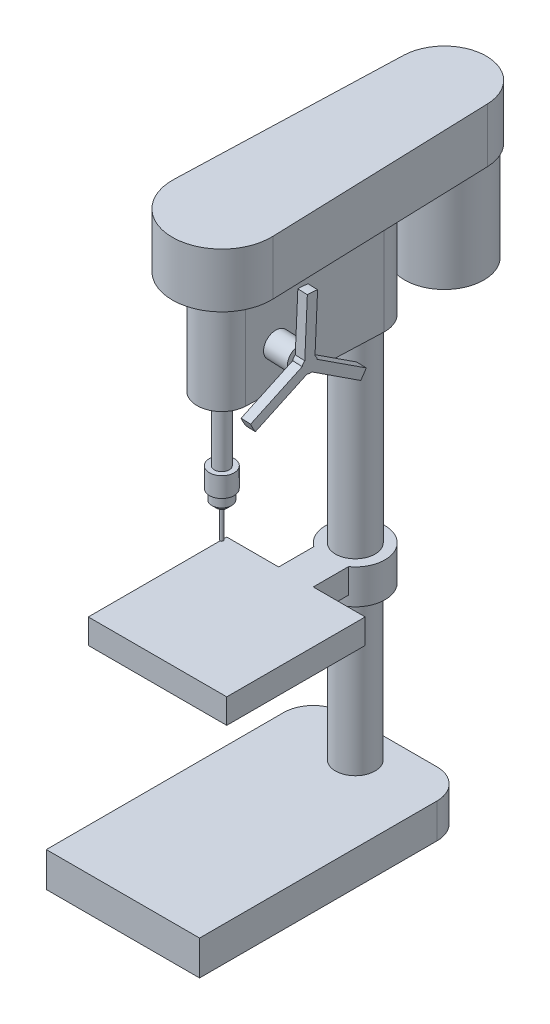
from build123d import *

# Parameters (mm, degrees)
SKETCH_1_W          = 310
SKETCH_1_H          = 540
EXTRUDE_1_DEPTH     = 70
FILLET_1_R          = 60
SKETCH_2_R          = 40
EXTRUDE_2_DEPTH     = 310
SKETCH_3_R          = 60
EXTRUDE_3_DEPTH     = 20
EXTRUDE_4_DEPTH     = 50
SKETCH_5_R          = 40
EXTRUDE_5_DEPTH     = 400
EXTRUDE_6_DEPTH     = 210
EXTRUDE_7_DEPTH     = 110
SKETCH_10_R         = 80
EXTRUDE_8_DEPTH     = 200
SKETCH_11_R         = 15
EXTRUDE_9_DEPTH     = 130
SKETCH_12_R         = 25
EXTRUDE_10_DEPTH    = 40
SKETCH_13_R         = 20
EXTRUDE_11_DEPTH    = 30
CHAMFER_1_SIZE      = 10
SKETCH_14_R         = 3.5
EXTRUDE_12_DEPTH    = 60
SKETCH_15_R         = 25
EXTRUDE_13_DEPTH    = 50
SKETCH_16_R         = 125
EXTRUDE_14_DEPTH    = 20
CUT_EXTRUDE_START   = -20
CUT_EXTRUDE_1_DEPTH = 20


with BuildPart() as part:
    # ｽｹｯﾁ1 → ﾎﾞｽ - 押し出し1 (new body)
    with BuildSketch(Plane(origin=(0, 0, 0), x_dir=(1, 0, 0), z_dir=(0, 1, 0))):
        with Locations((155, 270)):
            Rectangle(SKETCH_1_W, SKETCH_1_H)
    extrude(amount=EXTRUDE_1_DEPTH)

    # ﾌｨﾚｯﾄ1
    fillet_1_edges = [part.edges().sort_by_distance(p)[0] for p in [
        (0, 35, -540),
        (310, 35, -540),
    ]]
    fillet(fillet_1_edges, radius=FILLET_1_R)

    # ｽｹｯﾁ2 → ﾎﾞｽ - 押し出し2 (add)
    with BuildSketch(Plane(origin=(0, 70, 0), x_dir=(1, 0, 0), z_dir=(0, 1, 0))):
        with Locations(Location((155, 470, 0), (0, 0, 90))):
            Circle(SKETCH_2_R)
    extrude(amount=EXTRUDE_2_DEPTH)

    # ｽｹｯﾁ3 → ﾎﾞｽ - 押し出し3 (add)
    with BuildSketch(Plane(origin=(0, 380, 0), x_dir=(1, 0, 0), z_dir=(0, 1, 0))):
        with Locations(Location((155, 470, 0), (0, 0, 270))):
            Circle(SKETCH_3_R)
    extrude(amount=EXTRUDE_3_DEPTH)

    # ｽｹｯﾁ4 → ﾎﾞｽ - 押し出し4 (add)
    with BuildSketch(Plane(origin=(0, 400, 0), x_dir=(1, 0, 0), z_dir=(0, 1, 0))):
        with BuildLine():
            Line((190, 350), (295, 350))
            Line((295, 350), (295, 70))
            Line((295, 70), (15, 70))
            Line((15, 70), (15, 350))
            Line((15, 350), (120, 350))
            Line((120, 350), (120, 421.266028276))
            ThreePointArc((120, 421.266028276), (155, 530), (190, 421.266028276))
            Line((190, 421.266028276), (190, 350))
        make_face()
    extrude(amount=EXTRUDE_4_DEPTH)

    # ｽｹｯﾁ5 → ﾎﾞｽ - 押し出し5 (add)
    with BuildSketch(Plane(origin=(0, 450, 0), x_dir=(1, 0, 0), z_dir=(0, 1, 0))):
        with Locations(Location((155, 470, 0), (0, 0, 90))):
            Circle(SKETCH_5_R)
    extrude(amount=EXTRUDE_5_DEPTH)

    # ｽｹｯﾁ8 → ﾎﾞｽ - 押し出し6 (add)
    with BuildSketch(Plane(origin=(0, 850, 0), x_dir=(1, 0, 0), z_dir=(0, 1, 0))):
        with BuildLine():
            Line((95.041166386, 467.777777778), (105.034305321, 198.148148148))
            ThreePointArc((105.034305321, 198.148148148), (155, 150), (204.965694679, 198.148148148))
            Line((204.965694679, 198.148148148), (214.958833614, 467.777777778))
            ThreePointArc((214.958833614, 467.777777778), (155, 530), (95.041166386, 467.777777778))
        make_face()
    extrude(amount=EXTRUDE_6_DEPTH)

    # ｽｹｯﾁ9 → ﾎﾞｽ - 押し出し7 (add)
    with BuildSketch(Plane(origin=(0, 1060, 0), x_dir=(1, 0, 0), z_dir=(0, 1, 0))):
        with BuildLine():
            Line((55.055570996, 203.333333333), (70.047235347, 652.833333333))
            ThreePointArc((70.047235347, 652.833333333), (155, 735), (239.952764653, 652.833333333))
            Line((239.952764653, 652.833333333), (254.944429004, 203.333333333))
            ThreePointArc((254.944429004, 203.333333333), (155, 100), (55.055570996, 203.333333333))
        make_face()
    extrude(amount=EXTRUDE_7_DEPTH)

    # ｽｹｯﾁ10 → ﾎﾞｽ - 押し出し8 (add)
    with BuildSketch(Plane(origin=(0, 1060, 0), x_dir=(-1, 0, 0), z_dir=(0, -1, 0))):
        with Locations(Location((-155, 650, 0), (0, 0, 270))):
            Circle(SKETCH_10_R)
    extrude(amount=EXTRUDE_8_DEPTH)

    # ｽｹｯﾁ11 → ﾎﾞｽ - 押し出し9 (add)
    with BuildSketch(Plane(origin=(0, 850, 0), x_dir=(-1, 0, 0), z_dir=(0, -1, 0))):
        with Locations(Location((-155, 200, 0), (0, 0, 270))):
            Circle(SKETCH_11_R)
    extrude(amount=EXTRUDE_9_DEPTH)

    # ｽｹｯﾁ12 → ﾎﾞｽ - 押し出し10 (add)
    with BuildSketch(Plane(origin=(0, 720, 0), x_dir=(-1, 0, 0), z_dir=(0, -1, 0))):
        with Locations(Location((-155, 200, 0), (0, 0, 90))):
            Circle(SKETCH_12_R)
    extrude(amount=EXTRUDE_10_DEPTH)

    # ｽｹｯﾁ13 → ﾎﾞｽ - 押し出し11 (add)
    with BuildSketch(Plane(origin=(0, 680, 0), x_dir=(-1, 0, 0), z_dir=(0, -1, 0))):
        with Locations(Location((-155, 200, 0), (0, 0, 90))):
            Circle(SKETCH_13_R)
    extrude(amount=EXTRUDE_11_DEPTH)

    # 面取り1
    chamfer_1_edges = [part.edges().sort_by_distance(p)[0] for p in [
        (155, 650, -180),
    ]]
    chamfer(chamfer_1_edges, length=CHAMFER_1_SIZE)

    # ｽｹｯﾁ14 → ﾎﾞｽ - 押し出し12 (add)
    with BuildSketch(Plane(origin=(0, 650, 0), x_dir=(-1, 0, 0), z_dir=(0, -1, 0))):
        with Locations(Location((-155, 200, 0), (0, 0, 90))):
            Circle(SKETCH_14_R)
    extrude(amount=EXTRUDE_12_DEPTH)

    # ｽｹｯﾁ15 → ﾎﾞｽ - 押し出し13 (add)
    with BuildSketch(Plane(origin=(197.350749514, 0, 7.314305411), x_dir=(0.0370370370370371, 0, -0.9993138935727439), z_dir=(0.9993138935727439, 0, 0.0370370370370371))):
        with Locations(Location((265.603519455, 930, 0), (0, 0, 180))):
            Circle(SKETCH_15_R)
    extrude(amount=EXTRUDE_13_DEPTH)

    # ｽｹｯﾁ16 → ﾎﾞｽ - 押し出し14 (add)
    with BuildSketch(Plane(origin=(247.316444192, 0, 9.166157263), x_dir=(0.03703703703703711, 0, -0.9993138935727439), z_dir=(0.9993138935727439, 0, 0.03703703703703711))):
        with Locations((265.603519455, 930)):
            Circle(SKETCH_16_R)
    extrude(amount=EXTRUDE_14_DEPTH)

    # ｽｹｯﾁ17 → ｶｯﾄ - 押し出し1 (cut)
    with BuildSketch(Plane(origin=(267.302722064, 0, 9.906898004), x_dir=(0.037037037037037125, 0, -0.9993138935727439), z_dir=(0.9993138935727439, 0, 0.037037037037037125)).offset(CUT_EXTRUDE_START)):
        with BuildLine():
            Line((150.427943116, 881.424423678), (251.071784865, 933.718694636))
            ThreePointArc((251.071784865, 933.718694636), (252.958803035, 938.069147828), (256.109578031, 941.613142393))
            Line((256.109578031, 941.613142393), (261.143331784, 1054.92040156))
            ThreePointArc((261.143331784, 1054.92040156), (160.230882623, 997.242898563), (150.427943116, 881.424423678))
        make_face()
        with BuildLine():
            ThreePointArc((390.603519455, 930), (359.318547956, 1012.719365526), (281.123624526, 1054.032763166))
            Line((281.123624526, 1054.032763166), (276.089870774, 940.725503999))
            ThreePointArc((276.089870774, 940.725503999), (278.913964671, 936.916071729), (280.407766497, 932.415423259))
            Line((280.407766497, 932.415423259), (376.017854493, 871.402435049))
            ThreePointArc((376.017854493, 871.402435049), (386.90230733, 899.80721841), (390.603519455, 930))
        make_face()
        with BuildLine():
            Line((260.293213837, 915.971434348), (159.649372089, 863.677163391))
            ThreePointArc((159.649372089, 863.677163391), (260.055779492, 805.123170359), (365.258990723, 854.542813156))
            Line((365.258990723, 854.542813156), (269.648902727, 915.555801366))
            ThreePointArc((269.648902727, 915.555801366), (264.93779066, 915.014780443), (260.293213837, 915.971434348))
        make_face()
    extrude(amount=CUT_EXTRUDE_1_DEPTH, mode=Mode.SUBTRACT)


solid = part.part
